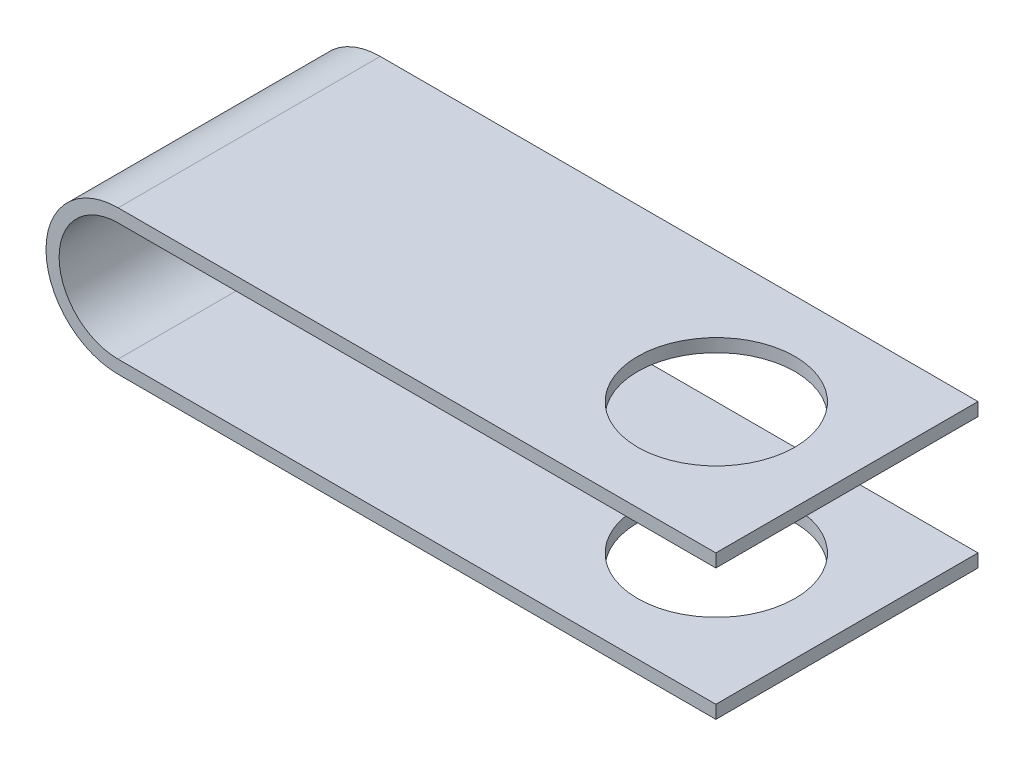
from build123d import *

# Parameters (mm, degrees)
BOSS_EXTRUDE1_DEPTH = 25.4
SKETCH3_R           = 7.62
CUT_EXTRUDE1_DEPTH  = 25.4


with BuildPart() as part:
    # Sketch2 → Boss-Extrude1 (new body)
    with BuildSketch(Plane.XY):
        with BuildLine():
            ThreePointArc((-57.912, 0), (-64.897, 6.985), (-57.912, 13.97))
            Line((-57.912, 13.97), (0, 13.97))
            Line((0, 13.97), (0, 12.7))
            Line((0, 12.7), (-57.912, 12.7))
            ThreePointArc((-57.912, 12.7), (-63.627, 6.985), (-57.912, 1.27))
            Line((-57.912, 1.27), (0, 1.27))
            Line((0, 1.27), (0, 0))
            Line((0, 0), (-57.912, 0))
        make_face()
    extrude(amount=BOSS_EXTRUDE1_DEPTH)

    # Sketch3 → Cut-Extrude1 (cut)
    with BuildSketch(Plane(origin=(0, 13.97, 0), x_dir=(1, 0, 0), z_dir=(0, 1, 0))):
        with Locations(Location((-12.65707914, -12.7, 0), (0, 0, 180))):
            Circle(SKETCH3_R)
    extrude(amount=-CUT_EXTRUDE1_DEPTH, mode=Mode.SUBTRACT)


solid = part.part
